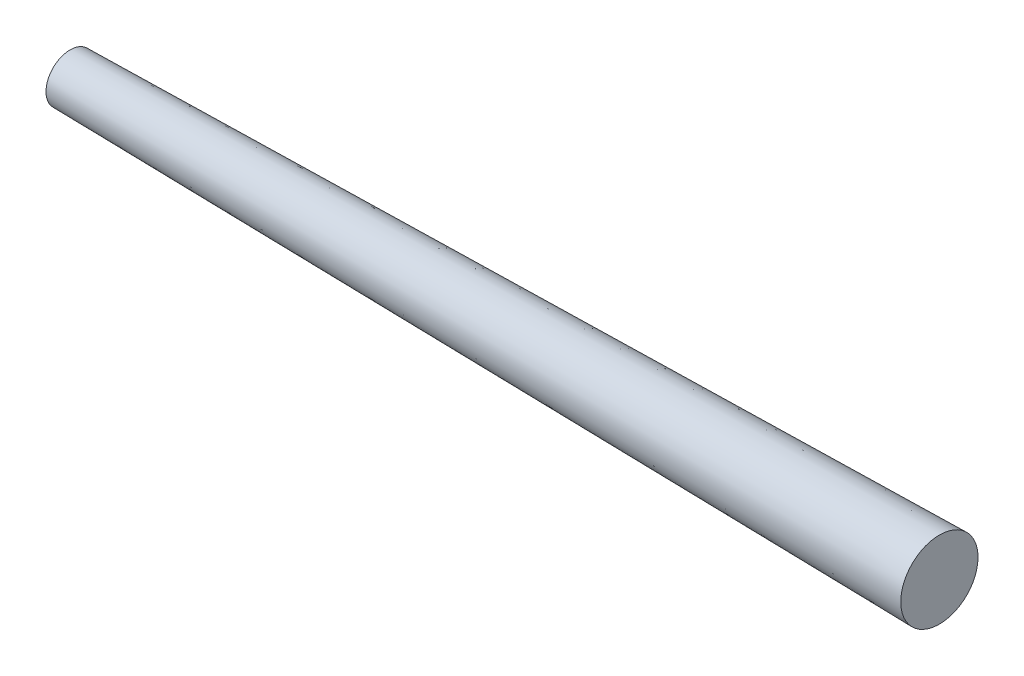
from build123d import *


with BuildPart() as part:
    # Skizze1 → Rotation1 (revolve)
    with BuildSketch(Plane.XY):
        Polygon((-10.538234355, 0), (-10.538234355, 2.5), (79.461765645, 4), (79.461765645, 0), align=None)
    revolve(axis=Axis((79.461765645, 0, 0), (-1, 0, 0)))


solid = part.part
